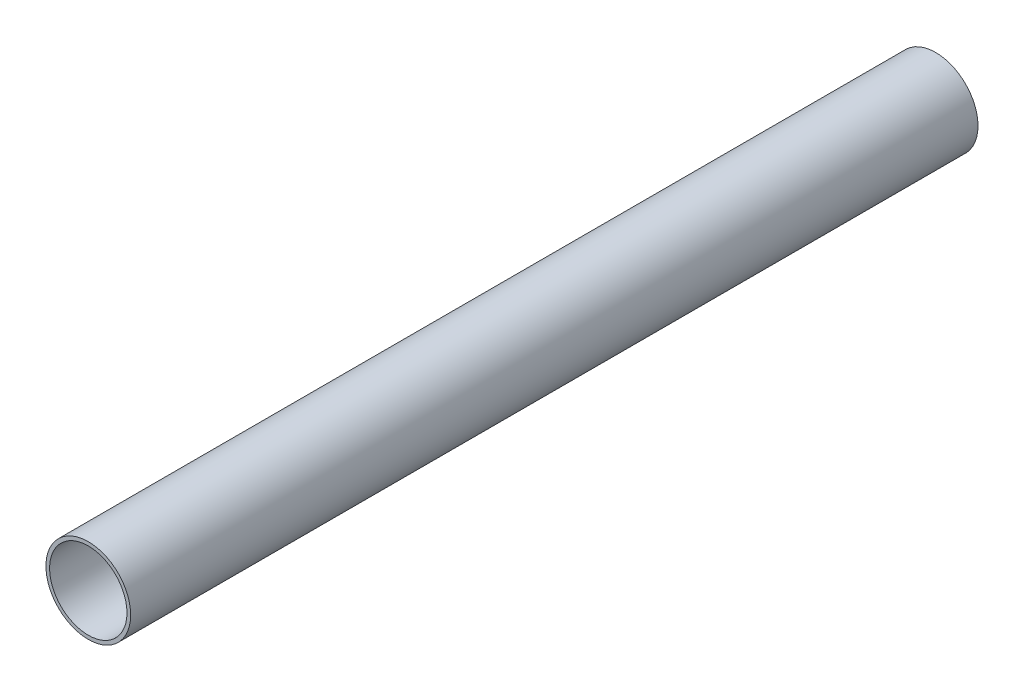
from build123d import *

# Parameters (mm, degrees)
SKETCH1_R           = 11.5
SKETCH1_R_2         = 10.5
BOSS_EXTRUDE1_DEPTH = 230


with BuildPart() as part:
    # Sketch1 → Boss-Extrude1 (new body)
    with BuildSketch(Plane.XY):
        Circle(SKETCH1_R)
        Circle(SKETCH1_R_2, mode=Mode.SUBTRACT)
    extrude(amount=BOSS_EXTRUDE1_DEPTH)


solid = part.part
